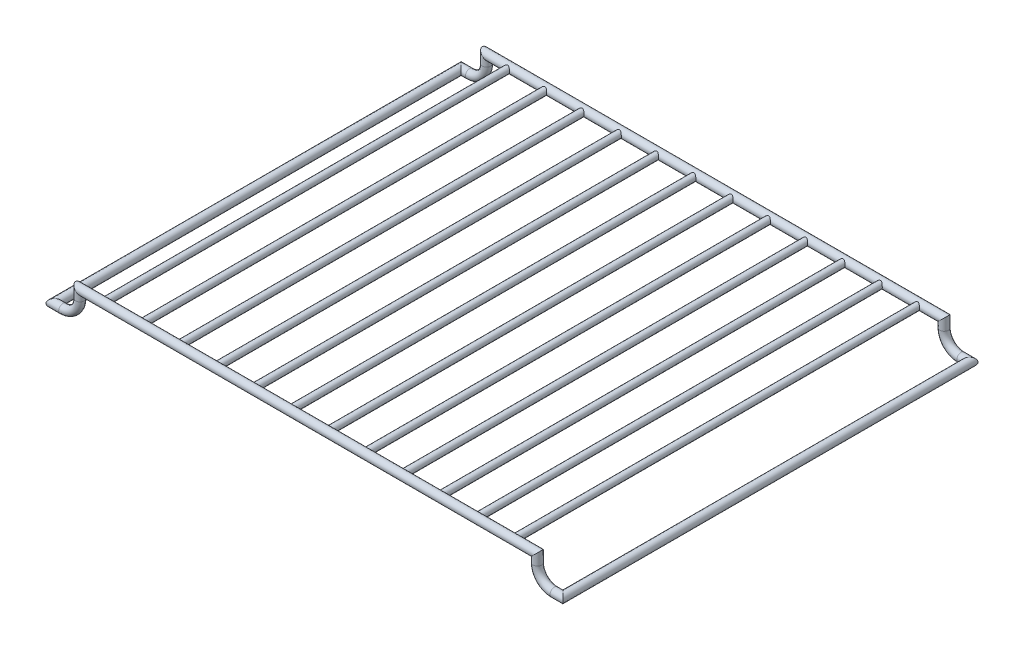
from build123d import *

# Parameters (mm, degrees)
SKETCH1_R                = 2.5
BOSS_EXTRUDE1_REACH      = 289
BOSS_EXTRUDE1_END_RADIUS = 2.5
SKETCH2_R                = 2
LPATTERN1_COUNT          = 6
LPATTERN1_PITCH          = 22


with BuildPart() as part:
    # Sweep1: sweep along a curve in space
    with BuildLine() as sweep1_path:
        Line((0, 0, 0), (135, 0, 0))
        Line((135, 0, 0), (135, -5, 0))
        ThreePointArc((135, -5, 0), (137.928932188, -12.071067812, 0), (145, -15, 0))
        Line((145, -15, 0), (150, -15, 0))
        Line((150, -15, 0), (150, -15, -240))
        Line((150, -15, -240), (145, -15, -240))
        ThreePointArc((145, -15, -240), (137.928932188, -12.071067812, -240), (135, -5, -240))
        Line((135, -5, -240), (135, 0, -240))
        Line((135, 0, -240), (0, 0, -240))
    # Sketch1 → Sweep1 (sweep)
    with BuildSketch(Plane(origin=(0, 0, 0), x_dir=(0, 0, -1), z_dir=(1, 0, 0))):
        Circle(SKETCH1_R)
    sweep(path=sweep1_path.line, transition=Transition.RIGHT)

    # Boss-Extrude1: up to this cylinder (the profile starts outside it)
    boss_extrude1_end = Plane(origin=(11, 0, -240), z_dir=(-1, 0, 0)) * Cylinder(BOSS_EXTRUDE1_END_RADIUS, 584, mode=Mode.PRIVATE)
    # Sketch2 → Boss-Extrude1 (add, up to the surface)
    with BuildSketch(Plane.XY, mode=Mode.PRIVATE) as boss_extrude1_sk1:
        with Locations((11, 0)):
            Circle(SKETCH2_R)
    boss_extrude1_tool1 = extrude(boss_extrude1_sk1.sketch, amount=-BOSS_EXTRUDE1_REACH, mode=Mode.PRIVATE) - boss_extrude1_end
    boss_extrude1 = boss_extrude1_tool1.solids().sort_by_distance((11, 0, 0))[0]
    add(boss_extrude1)

    # LPattern1: Boss-Extrude1 ×6
    with Locations(*[(i * LPATTERN1_PITCH, 0, 0) for i in range(1, LPATTERN1_COUNT)]):
        add(boss_extrude1)

    # Mirror1: part across plane


with BuildPart() as part_1:
    add(part.part)
    add(part.part.mirror(Plane(origin=(0, 0, -240), x_dir=(0, 0, 1), z_dir=(-1, 0, 0))))


solid = part_1.part
